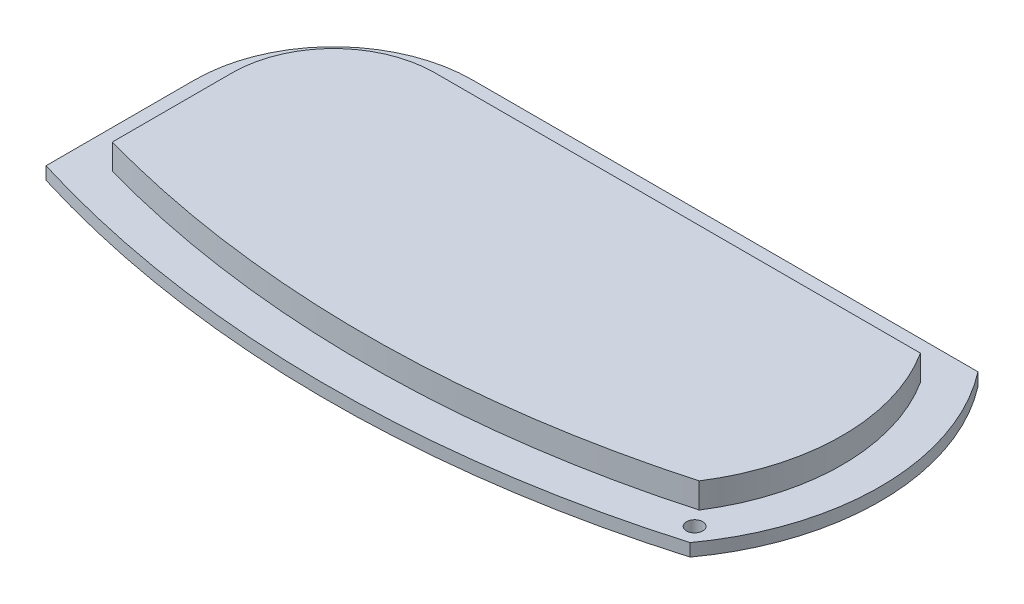
from build123d import *

# Parameters (mm, degrees)
EXTRUDE1_DEPTH = 6.35
EXTRUDE2_START = -3.175
EXTRUDE2_DEPTH = 3.175
SKETCH3_R      = 2.031713538
EXTRUDE5_DEPTH = 3.175


with BuildPart() as part:
    # Sketch1 → Extrude1 (new body)
    with BuildSketch(Plane(origin=(0, 0, 0), x_dir=(1, 0, 0), z_dir=(0, 1, 0))):
        with BuildLine():
            Line((73.709423741, 27.78667426), (-48.309423741, 27.78667426))
            ThreePointArc((-48.309423741, 27.78667426), (-66.269935984, 20.347186502), (-73.709423741, 2.38667426))
            Line((-73.709423741, 2.38667426), (-73.709423741, -27.78667426))
            ThreePointArc((-73.709423741, -27.78667426), (0, -37.894231138), (73.709423741, -27.78667426))
            ThreePointArc((73.709423741, -27.78667426), (81.838779599, 0), (73.709423741, 27.78667426))
        make_face()
    extrude(amount=EXTRUDE1_DEPTH)


with BuildPart() as body_2:
    # Sketch2 → Extrude2 (new body)
    with BuildSketch(Plane(origin=(0, 0, 0), x_dir=(1, 0, 0), z_dir=(0, 1, 0)).offset(EXTRUDE2_START)):
        with BuildLine():
            Line((78.642387847, 37.31167426), (-48.309423741, 37.31167426))
            ThreePointArc((-48.309423741, 37.31167426), (-73.005128074, 27.082378593), (-83.234423741, 2.38667426))
            Line((-83.234423741, 2.38667426), (-83.234423741, -34.917995668))
            ThreePointArc((-83.234423741, -34.917995668), (-1.883597248, -47.412970192), (79.626163145, -36.000682065))
            ThreePointArc((79.626163145, -36.000682065), (91.358281231, 0.819529495), (78.642387847, 37.31167426))
        make_face()
        with BuildLine():
            Line((73.709423741, 27.78667426), (-48.309423741, 27.78667426))
            ThreePointArc((-48.309423741, 27.78667426), (-66.269935984, 20.347186502), (-73.709423741, 2.38667426))
            Line((-73.709423741, 2.38667426), (-73.709423741, -27.78667426))
            ThreePointArc((-73.709423741, -27.78667426), (0, -37.894231138), (73.709423741, -27.78667426))
            ThreePointArc((73.709423741, -27.78667426), (81.838779599, 0), (73.709423741, 27.78667426))
        make_face(mode=Mode.SUBTRACT)
    extrude(amount=EXTRUDE2_DEPTH)

    # Sketch3 → Extrude5 (cut)
    with BuildSketch(Plane(origin=(0, 0, 0), x_dir=(1, 0, 0), z_dir=(0, 1, 0))):
        with Locations(Location((76.667793443, -31.893678163, 0), (0, 0, 270))):
            Circle(SKETCH3_R)
    extrude(amount=-EXTRUDE5_DEPTH, mode=Mode.SUBTRACT)


solid = Compound([part.part, body_2.part])
